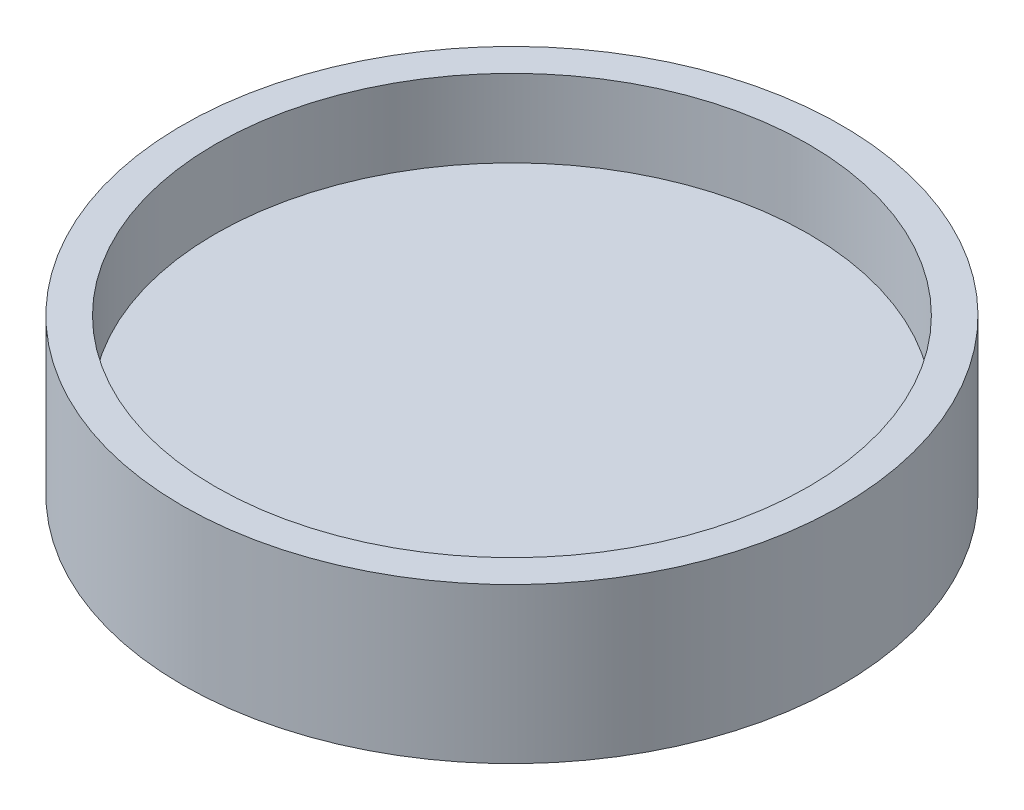
from build123d import *

# Parameters (mm, degrees)
SKETCH1_R           = 8.5
BOSS_EXTRUDE3_DEPTH = 4
SKETCH5_R           = 7.65
CUT_EXTRUDE2_DEPTH  = 2


with BuildPart() as part:
    # Sketch1 → Boss-Extrude3 (new body)
    with BuildSketch(Plane(origin=(0, 0, 0), x_dir=(1, 0, 0), z_dir=(0, 1, 0))):
        with Locations(Location((0, 0, 0), (0, 0, 270))):
            Circle(SKETCH1_R)
    extrude(amount=BOSS_EXTRUDE3_DEPTH)

    # Sketch5 → Cut-Extrude2 (cut)
    with BuildSketch(Plane(origin=(0, 4, 0), x_dir=(1, 0, 0), z_dir=(0, 1, 0))):
        with Locations(Location((0, 0, 0), (0, 0, 270))):
            Circle(SKETCH5_R)
    extrude(amount=-CUT_EXTRUDE2_DEPTH, mode=Mode.SUBTRACT)


solid = part.part
